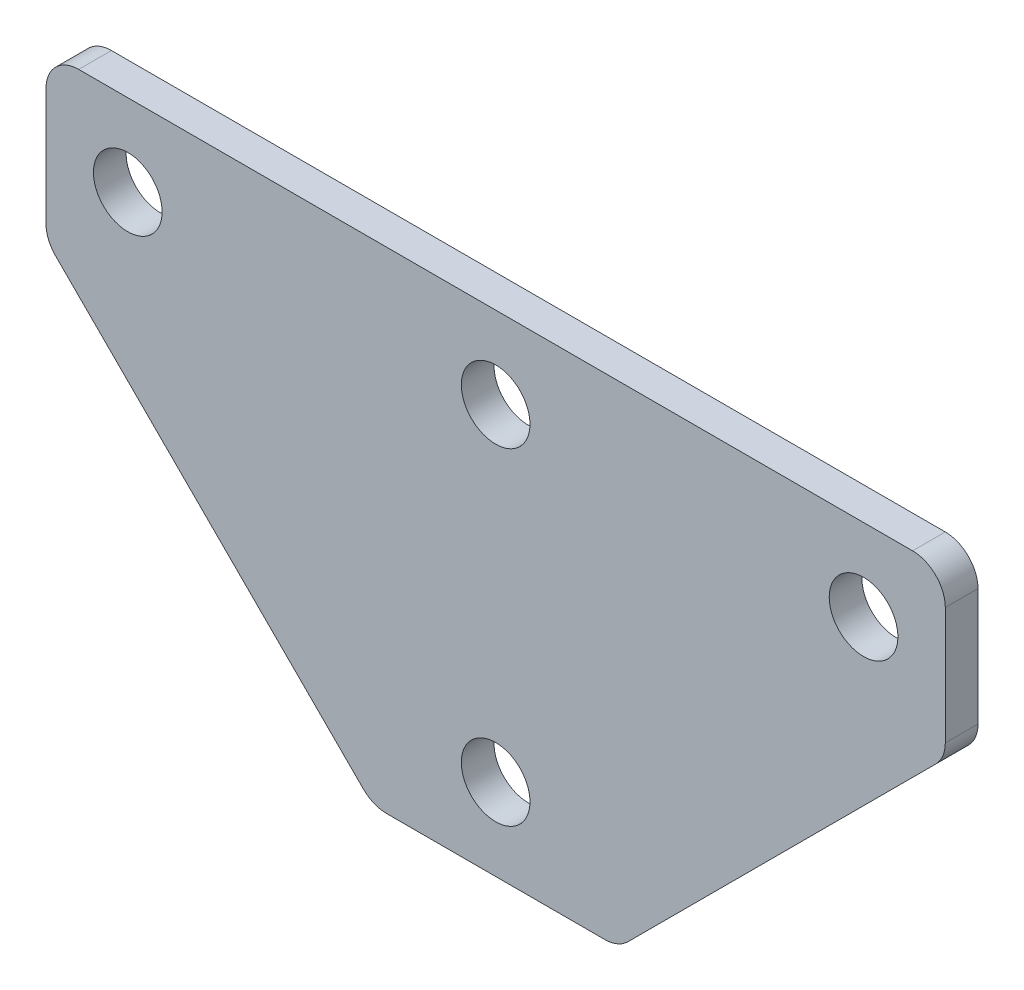
from build123d import *

# Parameters (mm, degrees)
SKETCH_1_R      = 2.1
EXTRUDE_1_DEPTH = 2
FILLET_1_R      = 2


with BuildPart() as part:
    # ｽｹｯﾁ1 → ﾎﾞｽ - 押し出し1 (new body)
    with BuildSketch(Plane.XY):
        Polygon((0, 0), (15, 0), (35, 20), (35, 30), (-20, 30), (-20, 20), align=None)
        with Locations((-15, 25)):
            Circle(SKETCH_1_R, mode=Mode.SUBTRACT)
        with Locations(Location((30, 25, 0), (0, 0, 180))):
            Circle(SKETCH_1_R, mode=Mode.SUBTRACT)
        with Locations((7.5, 25)):
            Circle(SKETCH_1_R, mode=Mode.SUBTRACT)
        with Locations((7.5, 5)):
            Circle(SKETCH_1_R, mode=Mode.SUBTRACT)
    extrude(amount=EXTRUDE_1_DEPTH)

    # ﾌｨﾚｯﾄ1
    fillet_1_edges = [part.edges().sort_by_distance(p)[0] for p in [
        (-20, 20, 1),
        (-20, 30, 1),
        (35, 30, 1),
        (35, 20, 1),
        (15, 0, 1),
        (0, 0, 1),
    ]]
    fillet(fillet_1_edges, radius=FILLET_1_R)


solid = part.part
